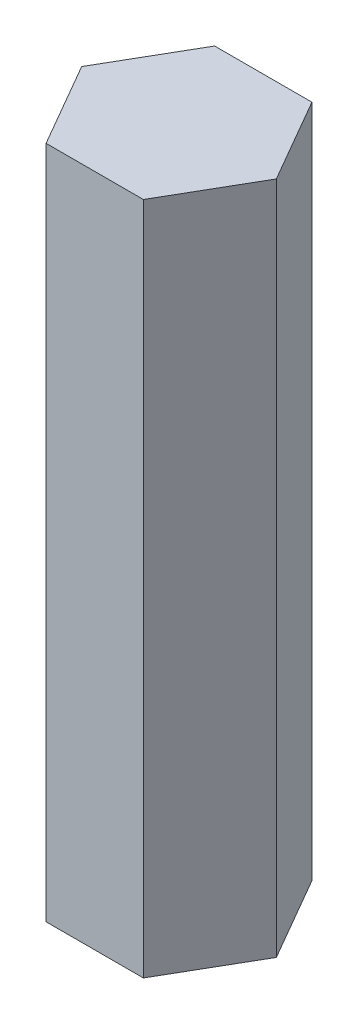
from build123d import *

# Parameters (mm, degrees)
BOSS_EXTRUDE1_DEPTH = 50.8


with BuildPart() as part:
    # Sketch1 → Boss-Extrude1 (new body)
    with BuildSketch(Plane(origin=(0, 0, 0), x_dir=(1, 0, 0), z_dir=(0, 1, 0))):
        Polygon((7.332348419, 0), (3.666174209, 6.35), (-3.666174209, 6.35), (-7.332348419, 0), (-3.666174209, -6.35), (3.666174209, -6.35), align=None)
    extrude(amount=BOSS_EXTRUDE1_DEPTH)


solid = part.part
